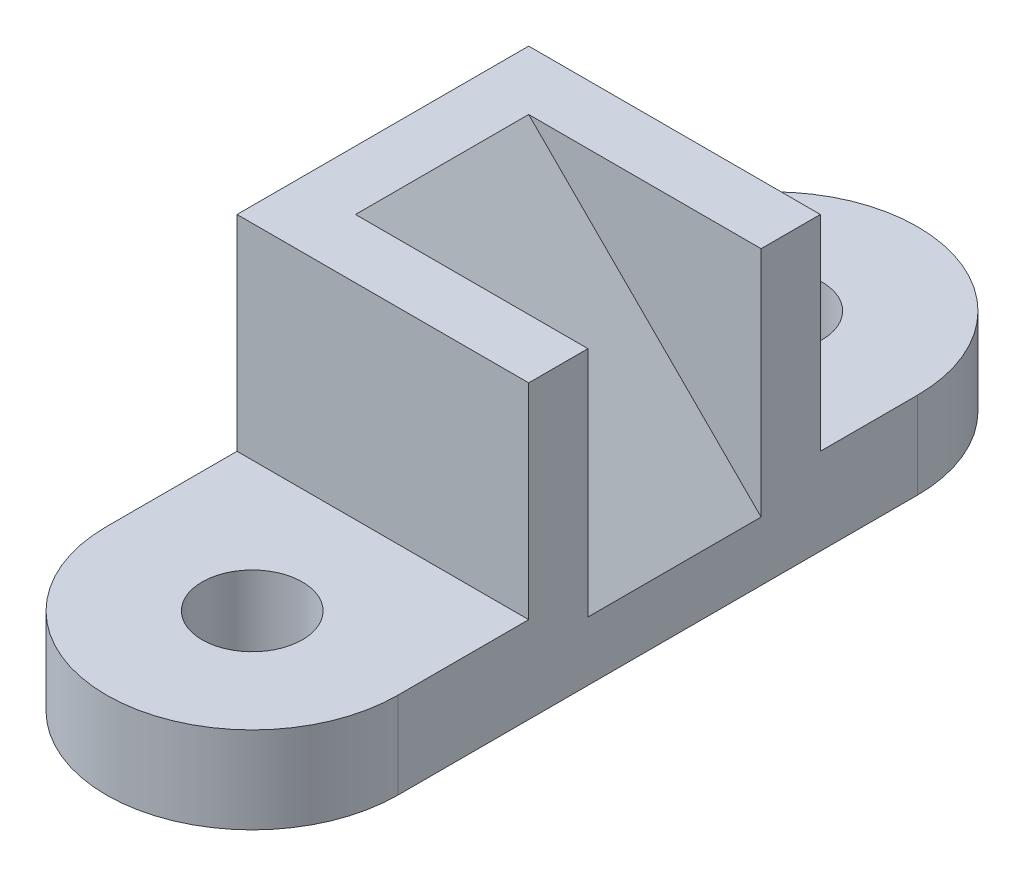
from build123d import *

# Parameters (mm, degrees)
SKETCH2_R             = 110
BOSS_EXTRUDE8_DEPTH   = 190
BOSS_EXTRUDE8_2_DEPTH = 190
BOSS_EXTRUDE9_DEPTH   = 640
SKETCH2_14_W          = 510.000000001
SKETCH2_14_H          = 380
BOSS_EXTRUDE10_DEPTH  = 130
BOSS_EXTRUDE11_REACH  = 1328.721


with BuildPart() as part:
    # Sketch2 → Boss-Extrude8 (new body)
    with BuildSketch(Plane(origin=(0, 0, 0), x_dir=(1, 0, 0), z_dir=(0, 1, 0))):
        with BuildLine():
            ThreePointArc((317.819938748, 566.60839198), (-2.180061253, 886.60839198), (-322.180061253, 566.60839198))
            Line((-322.180061253, 566.60839198), (-322.180061253, 353.205761503))
            Line((-322.180061253, 353.205761503), (317.819938748, 353.205761503))
            Line((317.819938748, 353.205761503), (317.819938748, 566.60839198))
        make_face()
        with Locations((-2.180061253, 566.60839198)):
            Circle(SKETCH2_R, mode=Mode.SUBTRACT)
    extrude(amount=BOSS_EXTRUDE8_DEPTH)



with BuildPart() as body_2:
    # Sketch2 → Boss-Extrude8 2 (new body)
    with BuildSketch(Plane(origin=(0, 0, 0), x_dir=(1, 0, 0), z_dir=(0, 1, 0))):
        with BuildLine():
            Line((317.819938748, -286.794238497), (-322.180061253, -286.794238497))
            Line((-322.180061253, -286.794238497), (-322.180061253, -573.39160802))
            ThreePointArc((-322.180061253, -573.39160802), (-2.180061253, -893.39160802), (317.819938748, -573.39160802))
            Line((317.819938748, -573.39160802), (317.819938748, -286.794238497))
        make_face()
        with Locations((-2.180061253, -573.39160802)):
            Circle(SKETCH2_R, mode=Mode.SUBTRACT)
    extrude(amount=BOSS_EXTRUDE8_2_DEPTH)


with BuildPart() as part_1:
    add(part.part)

    add(body_2.part)  # Boss-Extrude9 merges body 2
    # Sketch2<13> → Boss-Extrude9 (add)
    with BuildSketch(Plane(origin=(0, 0, 0), x_dir=(1, 0, 0), z_dir=(0, 1, 0))):
        Polygon((317.819938748, 353.205761503), (-322.180061253, 353.205761503), (-322.180061253, -286.794238497), (317.819938748, -286.794238497), (317.819938748, -156.794238497), (-192.180061253, -156.794238497), (-192.180061253, 223.205761503), (317.819938748, 223.205761503), align=None)
    extrude(amount=BOSS_EXTRUDE9_DEPTH)

    # Sketch2<14> → Boss-Extrude10 (add)
    with BuildSketch(Plane(origin=(0, 0, 0), x_dir=(1, 0, 0), z_dir=(0, 1, 0))):
        with Locations((62.819938748, 33.205761503)):
            Rectangle(SKETCH2_14_W, SKETCH2_14_H)
    extrude(amount=BOSS_EXTRUDE10_DEPTH)

    # Sketch13 → Boss-Extrude11 (add, up to next)
    with BuildSketch(Plane.XY.offset(-223.205761503), mode=Mode.PRIVATE) as boss_extrude11_sk1:
        Polygon((-192.180061253, 640), (317.819938748, 130), (-192.180061253, 130), align=None)
    boss_extrude11_tool1 = extrude(boss_extrude11_sk1.sketch, amount=BOSS_EXTRUDE11_REACH, mode=Mode.PRIVATE) - part_1.part
    add(boss_extrude11_tool1.solids().sort_by_distance((-22.180061, 300, -223.205762))[0])


solid = part_1.part
